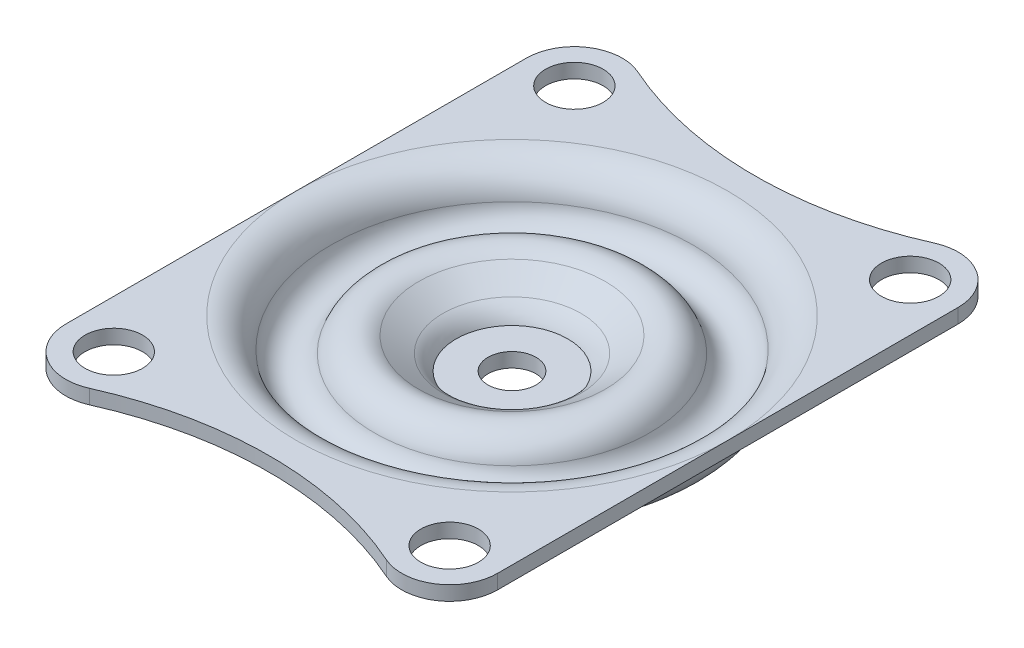
from build123d import *

# Parameters (mm, degrees)
SKETCH2_OUTSIDE_W  = 177.772
SKETCH2_OUTSIDE_H  = 177.772
SKETCH2_OUTSIDE_R  = 3
CUT_EXTRUDE1_DEPTH = 10
CUT_EXTRUDE2_REACH = 39.044
SKETCH3_R          = 2.5


with BuildPart() as part:
    # Sketch1 → Revolve-Thin1 (revolve)
    with BuildSketch(Plane.XY, mode=Mode.PRIVATE) as revolve_thin1_sk:
        with BuildLine():
            Line((0, 0), (-7, 0))
            ThreePointArc((-7, 0), (-7.269044642, 1.051679852), (-8.010073527, 1.844958947))
            Line((-8.010073527, 1.844958947), (-10.537414551, 3.461296582))
            ThreePointArc((-10.537414551, 3.461296582), (-11.937999931, 3.623016312), (-12.92723115, 2.618419738))
            ThreePointArc((-12.92723115, 2.618419738), (-16.861755462, 0.011298259), (-20.351496609, 3.189233233))
            ThreePointArc((-20.351496609, 3.189233233), (-21.09510293, 4.486932579), (-22.5, 5))
            Line((-22.5, 5), (-68.5, 5))
            Line((-68.5, 5), (-68.5, 6.5))
            Line((-68.5, 6.5), (-22.5, 6.5))
            ThreePointArc((-22.5, 6.5), (-20.128430635, 5.633904537), (-18.873168588, 3.443292796))
            ThreePointArc((-18.873168588, 3.443292796), (-16.746767558, 1.506884358), (-14.349347177, 3.095479491))
            ThreePointArc((-14.349347177, 3.095479491), (-12.436920682, 5.037610983), (-9.729245733, 4.724967094))
            Line((-9.729245733, 4.724967094), (-7.20190471, 3.108629459))
            ThreePointArc((-7.20190471, 3.108629459), (-6.392166006, 2.405873011), (-5.818635291, 1.5))
            Line((-5.818635291, 1.5), (0, 1.5))
            Line((0, 1.5), (0, 0))
        make_face()
    revolve(revolve_thin1_sk.sketch.rotate(Axis((0, 0, 0), (0, 1, 0)), 270), axis=Axis((0, 0, 0), (0, 1, 0)))

    # Sketch2 outside → Cut-Extrude1 (cut)
    # profile 1 of 5: a face of its own
    with BuildSketch(Plane(origin=(0, 6.5, 0), x_dir=(1, 0, 0), z_dir=(0, 1, 0))):
        Rectangle(SKETCH2_OUTSIDE_W, SKETCH2_OUTSIDE_H)
        with BuildLine():
            Line((-22.5, 24), (-22.5, -24))
            ThreePointArc((-22.5, -24), (-20.223031672, -28.193459015), (-15.465960595, -28.567568686))
            ThreePointArc((-15.465960595, -28.567568686), (0, -25.279547003), (15.465960595, -28.567568686))
            ThreePointArc((15.465960595, -28.567568686), (20.223031672, -28.193459015), (22.5, -24))
            Line((22.5, -24), (22.5, 24))
            ThreePointArc((22.5, 24), (20.223031672, 28.193459015), (15.465960595, 28.567568686))
            ThreePointArc((15.465960595, 28.567568686), (0, 25.279547003), (-15.465960595, 28.567568686))
            ThreePointArc((-15.465960595, 28.567568686), (-20.223031672, 28.193459015), (-22.5, 24))
        make_face(mode=Mode.SUBTRACT)
    # profile 2 of 5: a face of its own
    with BuildSketch(Plane(origin=(0, 6.5, 0), x_dir=(1, 0, 0), z_dir=(0, 1, 0))):
        with Locations(Location((-17.5, 24, 0), (0, 0, 270))):
            Circle(SKETCH2_OUTSIDE_R)
    # profile 3 of 5: a face of its own
    with BuildSketch(Plane(origin=(0, 6.5, 0), x_dir=(1, 0, 0), z_dir=(0, 1, 0))):
        with Locations(Location((17.5, 24, 0), (0, 0, 90))):
            Circle(SKETCH2_OUTSIDE_R)
    # profile 4 of 5: a face of its own
    with BuildSketch(Plane(origin=(0, 6.5, 0), x_dir=(1, 0, 0), z_dir=(0, 1, 0))):
        with Locations(Location((17.5, -24, 0), (0, 0, 270))):
            Circle(SKETCH2_OUTSIDE_R)
    # profile 5 of 5: a face of its own
    with BuildSketch(Plane(origin=(0, 6.5, 0), x_dir=(1, 0, 0), z_dir=(0, 1, 0))):
        with Locations(Location((-17.5, -24, 0), (0, 0, 90))):
            Circle(SKETCH2_OUTSIDE_R)
    extrude(amount=-CUT_EXTRUDE1_DEPTH, mode=Mode.SUBTRACT)

    # Sketch3 → Cut-Extrude2 (cut, up to next)
    with BuildSketch(Plane(origin=(0, 1.5, 0), x_dir=(1, 0, 0), z_dir=(0, 1, 0)), mode=Mode.PRIVATE) as cut_extrude2_sk1:
        with Locations(Location((0, 0, 0), (0, 0, 270))):
            Circle(SKETCH3_R)
    cut_extrude2_tool1 = extrude(cut_extrude2_sk1.sketch, amount=-CUT_EXTRUDE2_REACH, mode=Mode.PRIVATE) & part.part
    add(cut_extrude2_tool1.solids().sort_by_distance((0, 1.5, 0))[0], mode=Mode.SUBTRACT)


solid = part.part
